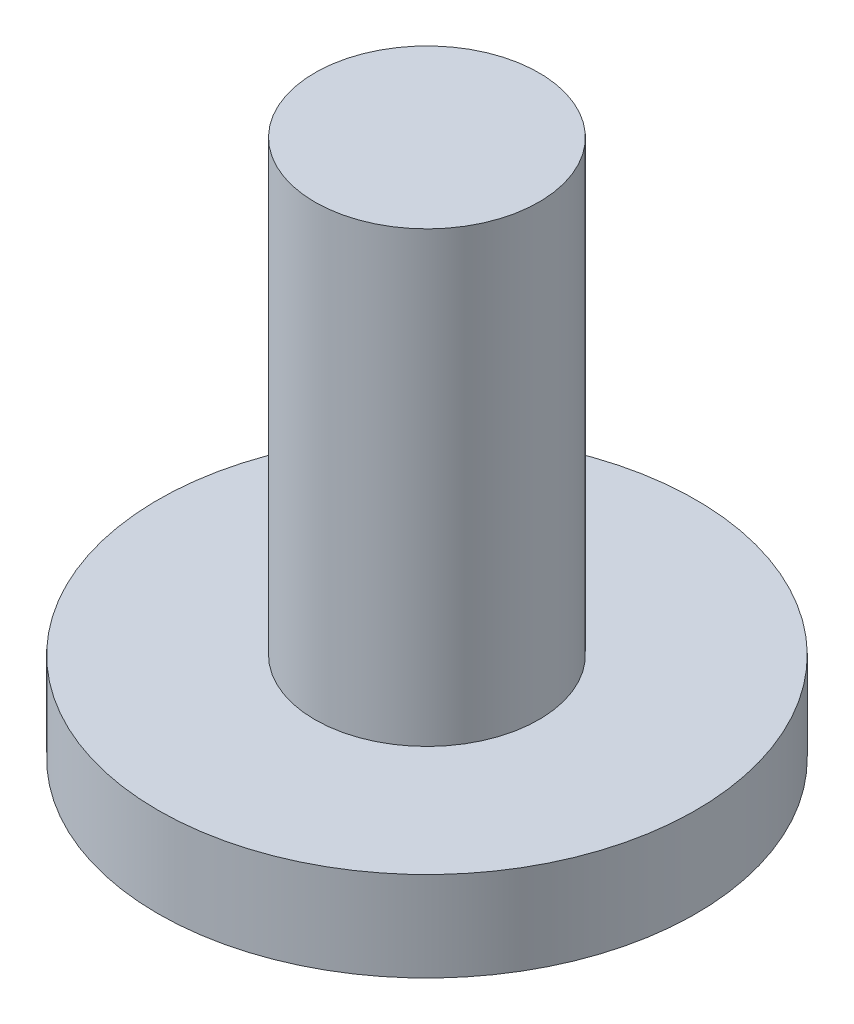
from build123d import *

# Parameters (mm, degrees)
CROQUIS1_R              = 6
SALIENTE_EXTRUIR1_DEPTH = 2
CROQUIS2_R              = 2.5
SALIENTE_EXTRUIR2_DEPTH = 10


with BuildPart() as part:
    # Croquis1 → Saliente-Extruir1 (new body)
    with BuildSketch(Plane(origin=(0, 0, 0), x_dir=(1, 0, 0), z_dir=(0, 1, 0))):
        with Locations(Location((0, 0, 0), (0, 0, 270))):
            Circle(CROQUIS1_R)
    extrude(amount=SALIENTE_EXTRUIR1_DEPTH)

    # Croquis2 → Saliente-Extruir2 (add)
    with BuildSketch(Plane(origin=(0, 2, 0), x_dir=(1, 0, 0), z_dir=(0, 1, 0))):
        with Locations(Location((0, 0, 0), (0, 0, 270))):
            Circle(CROQUIS2_R)
    extrude(amount=SALIENTE_EXTRUIR2_DEPTH)


solid = part.part
